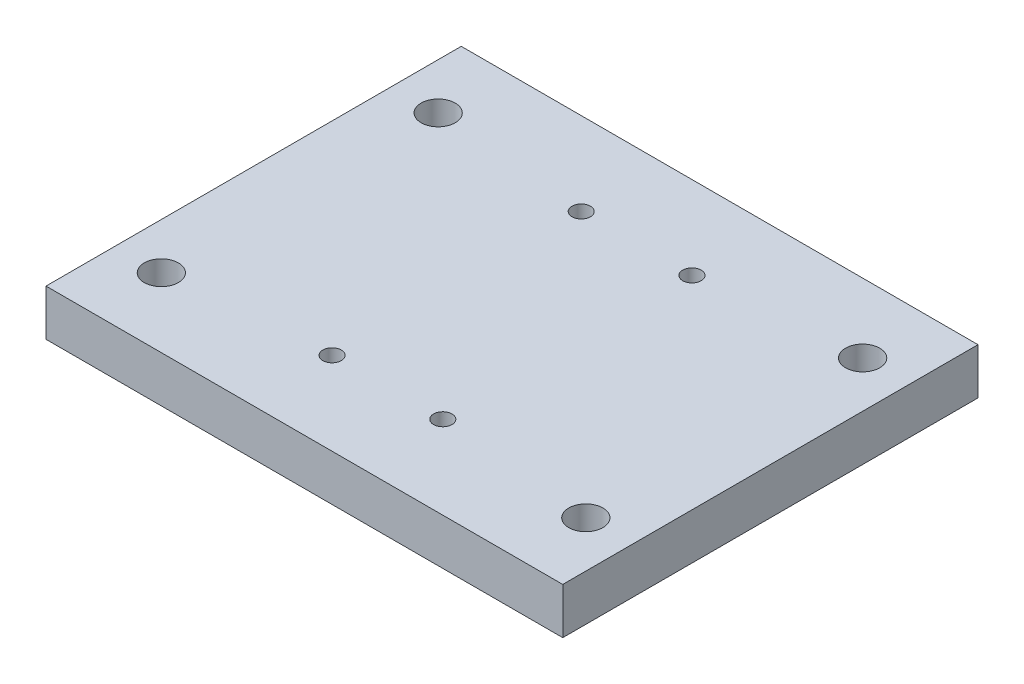
from build123d import *

# Parameters (mm, degrees)
SKETCH2_W           = 56
SKETCH2_H           = 45
BOSS_EXTRUDE1_DEPTH = 5
SKETCH3_R           = 1.85
CUT_EXTRUDE1_DEPTH  = 3
SKETCH4_R           = 1
CUT_EXTRUDE2_DEPTH  = 5


with BuildPart() as part:
    # Sketch2 → Boss-Extrude1 (new body)
    with BuildSketch(Plane(origin=(0, 0, 0), x_dir=(1, 0, 0), z_dir=(0, 1, 0))):
        with Locations((28, 22.5)):
            Rectangle(SKETCH2_W, SKETCH2_H)
    extrude(amount=BOSS_EXTRUDE1_DEPTH)

    # Sketch3 → Cut-Extrude1 (cut)
    with BuildSketch(Plane(origin=(0, 5, 0), x_dir=(1, 0, 0), z_dir=(0, 1, 0))):
        with Locations(Location((5, 37.5, 0), (0, 0, 270))):
            Circle(SKETCH3_R)
        with Locations(Location((51, 37.5, 0), (0, 0, 270))):
            Circle(SKETCH3_R)
        with Locations(Location((51, 7.5, 0), (0, 0, 270))):
            Circle(SKETCH3_R)
        with Locations(Location((5, 7.5, 0), (0, 0, 270))):
            Circle(SKETCH3_R)
    extrude(amount=-CUT_EXTRUDE1_DEPTH, mode=Mode.SUBTRACT)

    # Sketch4 → Cut-Extrude2 (cut)
    with BuildSketch(Plane(origin=(0, 5, 0), x_dir=(1, 0, 0), z_dir=(0, 1, 0))):
        with Locations(Location((22, 36, 0), (0, 0, 270))):
            Circle(SKETCH4_R)
        with Locations(Location((22, 9, 0), (0, 0, 270))):
            Circle(SKETCH4_R)
        with Locations(Location((34, 9, 0), (0, 0, 270))):
            Circle(SKETCH4_R)
        with Locations(Location((34, 36, 0), (0, 0, 270))):
            Circle(SKETCH4_R)
    extrude(amount=-CUT_EXTRUDE2_DEPTH, mode=Mode.SUBTRACT)


solid = part.part
